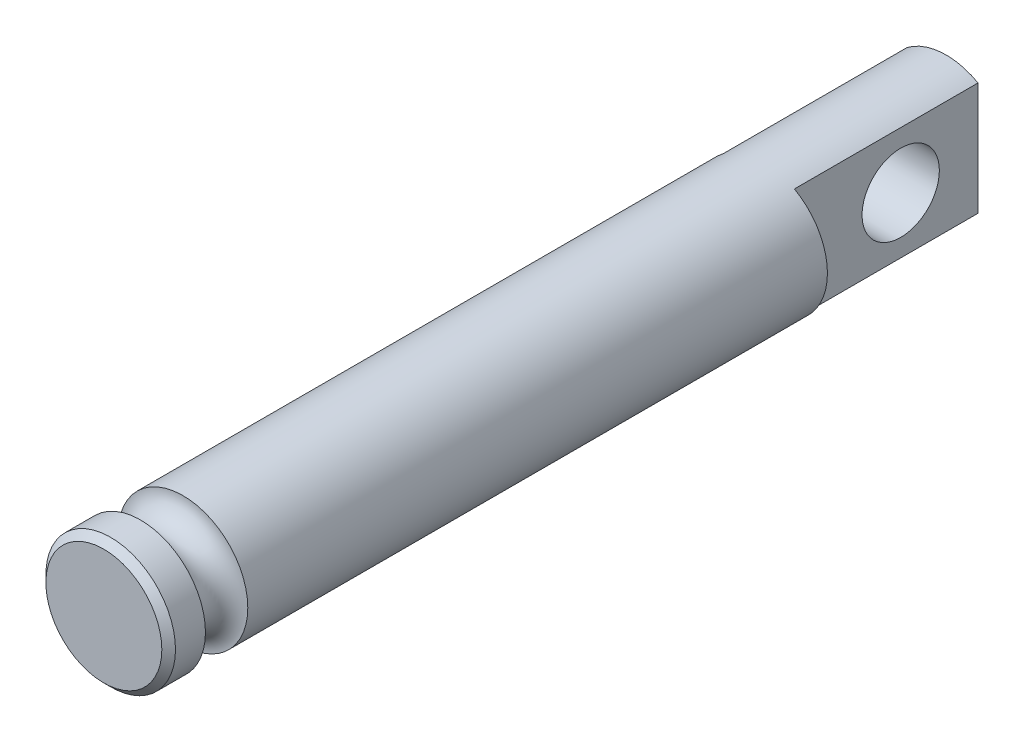
from build123d import *

# Parameters (mm, degrees)
CORTE_EXTRUS_O1_DEPTH      = 88.705522097
CORTE_EXTRUS_O1_DEPTH_BACK = 88.705522097
ESBO_O2_W                  = 3.414213562
ESBO_O2_H                  = 19
ESBO_O2_W_2                = 2.65
CORTE_EXTRUS_O2_DEPTH      = 89.018596472
CORTE_EXTRUS_O2_DEPTH_BACK = 89.018596472
ESBO_O3_R                  = 4


with BuildPart() as part:
    # Esboço1 → Revolução1 (revolve)
    with BuildSketch(Plane(origin=(0, 0, 0), x_dir=(0, 0, -1), z_dir=(1, 0, 0)), mode=Mode.PRIVATE) as revolu_o1_sk:
        with BuildLine():
            Line((0, 0), (0, 6))
            Line((0, 6), (0.707106781, 6.707106781))
            Line((0.707106781, 6.707106781), (3.808899287, 6.707106781))
            ThreePointArc((3.808899287, 6.707106781), (6, 4.516006068), (8.191100713, 6.707106781))
            Line((8.191100713, 6.707106781), (87.191100713, 6.707106781))
            Line((87.191100713, 6.707106781), (87.191100713, 0))
            Line((87.191100713, 0), (0, 0))
        make_face()
    revolve(revolu_o1_sk.sketch.rotate(Axis((0, 0, 0), (0, 0, -1)), 90), axis=Axis((0, 0, 0), (0, 0, -1)))

    # Esboço2 → Corte-extrusão1 (cut, two sides: drawn at the far end of the back side and taken through both)
    with BuildSketch(Plane(origin=(0, 0, 0), x_dir=(1, 0, 0), z_dir=(0, 1, 0)).offset(-CORTE_EXTRUS_O1_DEPTH_BACK)):
        with Locations((5, 77.691100713)):
            Rectangle(ESBO_O2_W, ESBO_O2_H)
        with Locations((-5.382106781, 77.691100713)):
            Rectangle(ESBO_O2_W_2, ESBO_O2_H)
    extrude(amount=CORTE_EXTRUS_O1_DEPTH + CORTE_EXTRUS_O1_DEPTH_BACK, mode=Mode.SUBTRACT)

    # Esboço3 → Corte-extrusão2 (cut, two sides: drawn at the far end of the back side and taken through both)
    with BuildSketch(Plane(origin=(3.292893219, 0, 0), x_dir=(0, 0, -1), z_dir=(1, 0, 0)).offset(-CORTE_EXTRUS_O2_DEPTH_BACK)):
        with Locations((79.191100713, 0)):
            Circle(ESBO_O3_R)
    extrude(amount=CORTE_EXTRUS_O2_DEPTH + CORTE_EXTRUS_O2_DEPTH_BACK, mode=Mode.SUBTRACT)


solid = part.part
